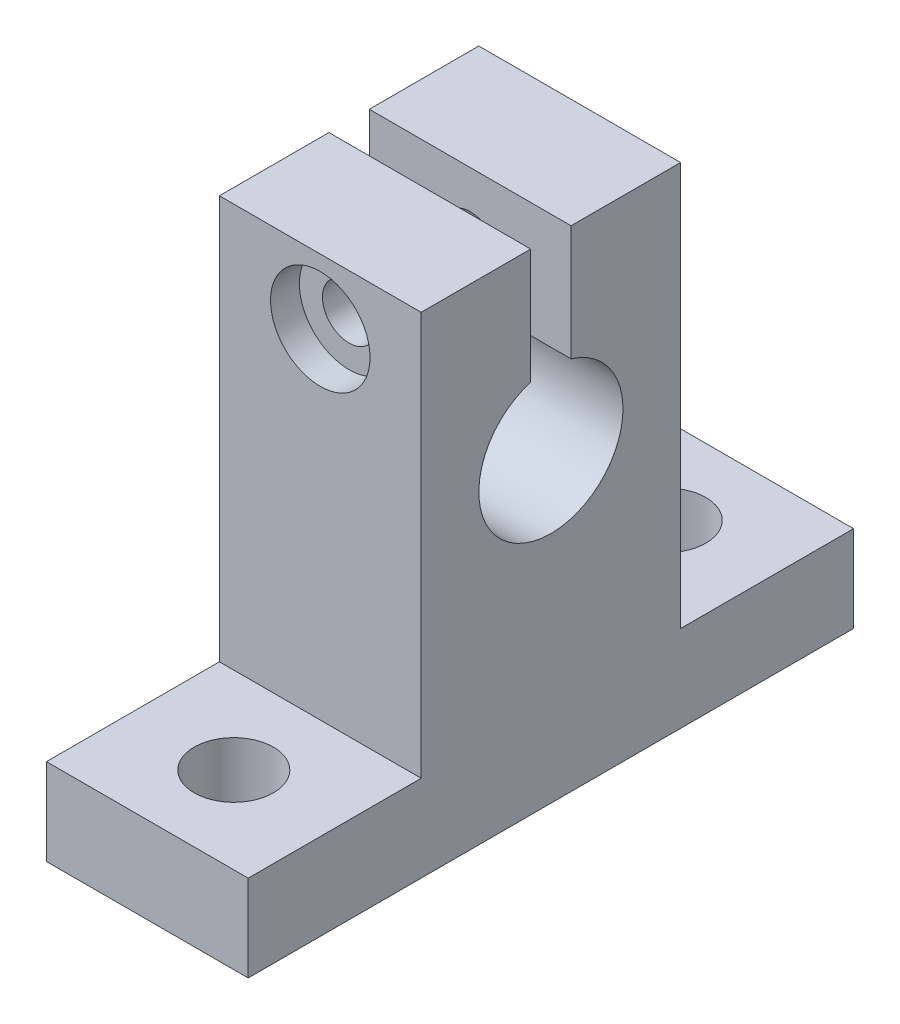
from build123d import *

# Parameters (mm, degrees)
BOSS_EXTRUDE1_DEPTH = 14
SKETCH3_R           = 1.85
CUT_EXTRUDE1_DEPTH  = 48.455242071
SKETCH4_R           = 2.75
CUT_EXTRUDE2_DEPTH  = 53.383203415
SKETCH5_R           = 3.452522479
CUT_EXTRUDE3_DEPTH  = 2


with BuildPart() as part:
    # Sketch2 → Boss-Extrude1 (new body)
    with BuildSketch(Plane(origin=(0, 0, 0), x_dir=(0, 0, -1), z_dir=(1, 0, 0))):
        with BuildLine():
            Line((0, 0), (42, 0))
            Line((42, 0), (42, 6))
            Line((42, 6), (30, 6))
            Line((30, 6), (30, 34))
            Line((30, 34), (22.4, 34))
            Line((22.4, 34), (22.4, 26))
            ThreePointArc((22.4, 26), (21, 16.2), (19.6, 26))
            Line((19.6, 26), (19.6, 34))
            Line((19.6, 34), (12, 34))
            Line((12, 34), (12, 6))
            Line((12, 6), (0, 6))
            Line((0, 6), (0, 0))
        make_face()
    extrude(amount=BOSS_EXTRUDE1_DEPTH)

    # Sketch3 → Cut-Extrude1 (cut, through all)
    with BuildSketch(Plane(origin=(0, 0, -30), x_dir=(-1, 0, 0), z_dir=(0, 0, -1))):
        with Locations((-7, 29.5)):
            Circle(SKETCH3_R)
    extrude(amount=-CUT_EXTRUDE1_DEPTH, mode=Mode.SUBTRACT)

    # Sketch4 → Cut-Extrude2 (cut, through all)
    with BuildSketch(Plane(origin=(0, 6, 0), x_dir=(1, 0, 0), z_dir=(0, 1, 0))):
        with Locations(Location((7, 36, 0), (0, 0, 270))):
            Circle(SKETCH4_R)
        with Locations(Location((7, 6, 0), (0, 0, 270))):
            Circle(SKETCH4_R)
    extrude(amount=-CUT_EXTRUDE2_DEPTH, mode=Mode.SUBTRACT)

    # Sketch5 → Cut-Extrude3 (cut)
    with BuildSketch(Plane.XY.offset(-12)):
        with Locations((7, 29.5)):
            Circle(SKETCH5_R)
    extrude(amount=-CUT_EXTRUDE3_DEPTH, mode=Mode.SUBTRACT)


solid = part.part
